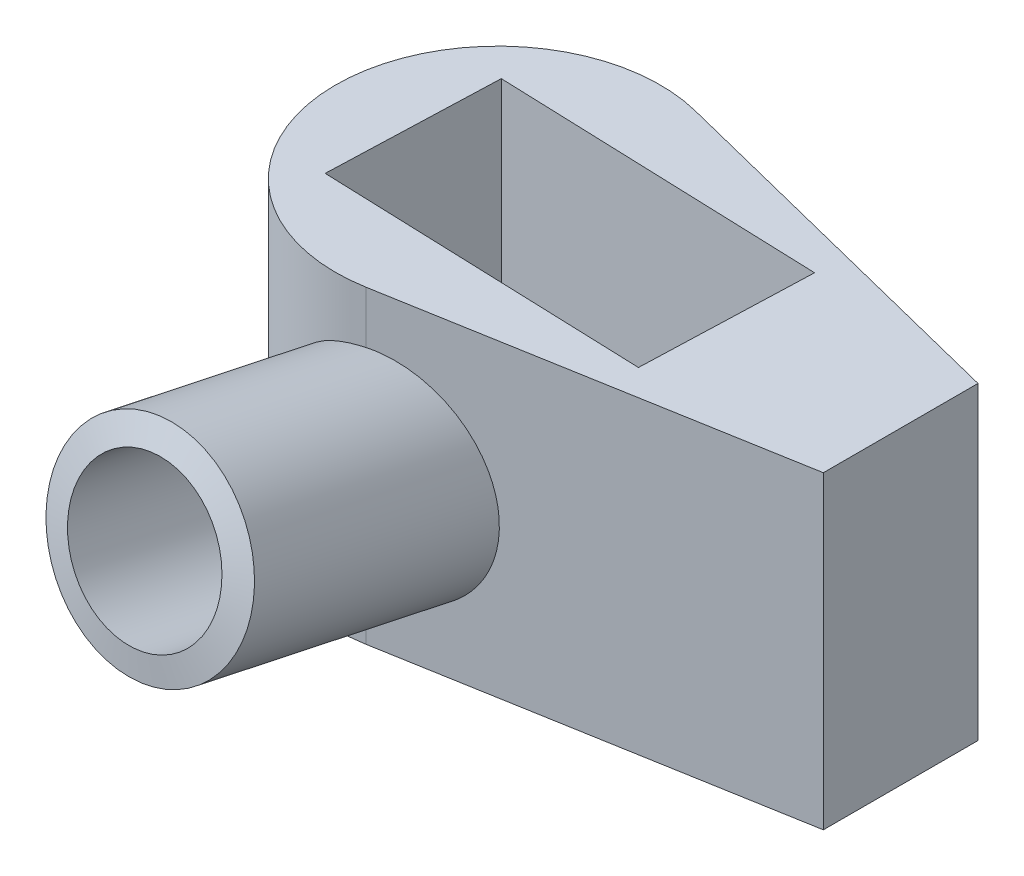
from build123d import *

# Parameters (mm, degrees)
CROQUIS1_R              = 21
SALIENTE_EXTRUIR1_DEPTH = 40
SALIENTE_EXTRUIR2_DEPTH = 40
SALIENTE_EXTRUIR3_REACH = 77.493
CROQUIS3_R              = 13.5
CROQUIS3_R_2            = 10
CROQUIS7_R              = 8.227269221
CROQUIS7_R_2            = 6
CORTAR_EXTRUIR6_DEPTH   = 6
CROQUIS8_R              = 6
CORTAR_EXTRUIR7_DEPTH   = 72.223648425
CORTAR_EXTRUIR8_START   = -25
CORTAR_EXTRUIR8_DEPTH   = 25
CROQUIS12_R             = 9.55
CORTAR_EXTRUIR9_DEPTH   = 5.5
CORTAR_EXTRUIR10_DEPTH  = 86.45696425


with BuildPart() as part:
    # Croquis1 → Saliente-Extruir1 (new body)
    with BuildSketch(Plane(origin=(0, 0, 0), x_dir=(1, 0, 0), z_dir=(0, 1, 0))):
        with Locations(Location((0, 0, 0), (0, 0, 270))):
            Circle(CROQUIS1_R)
    extrude(amount=SALIENTE_EXTRUIR1_DEPTH)

    # Croquis2 → Saliente-Extruir2 (add)
    with BuildSketch(Plane(origin=(0, 0, 0), x_dir=(1, 0, 0), z_dir=(0, 1, 0))):
        with BuildLine():
            Line((53.975127576, 8.110971331), (53.975127576, -11.889028669))
            Line((53.975127576, -11.889028669), (3.613793412, -20.686722727))
            ThreePointArc((3.613793412, -20.686722727), (20.98607707, -0.764571273), (5.109545014, 20.368911354))
            Line((5.109545014, 20.368911354), (53.975127576, 8.110971331))
        make_face()
    extrude(amount=SALIENTE_EXTRUIR2_DEPTH)

    # Croquis3 → Saliente-Extruir3 (add, up to next)
    with BuildSketch(Plane(origin=(5.109545014, 0, -20.368911354), x_dir=(-0.9699481597219111, 0, -0.24331166731597212), z_dir=(0.2433116673159721, 0, -0.969948159721911)), mode=Mode.PRIVATE) as saliente_extruir3_sk1:
        with Locations((0, 20)):
            Circle(CROQUIS3_R)
        with Locations((0, 20)):
            Circle(CROQUIS3_R_2, mode=Mode.SUBTRACT)
    saliente_extruir3_tool1 = extrude(saliente_extruir3_sk1.sketch, amount=-SALIENTE_EXTRUIR3_REACH, mode=Mode.PRIVATE) - part.part
    add(saliente_extruir3_tool1.solids().sort_by_distance((17.833482, 20, -17.177109))[0])

    # Croquis7 → Cortar-Extruir6 (cut)
    with BuildSketch(Plane.XZ):
        with Locations(Location((0, 0, 0), (0, 0, 270))):
            Circle(CROQUIS7_R)
        with Locations(Location((0, 0, 0), (0, 0, 270))):
            Circle(CROQUIS7_R_2, mode=Mode.SUBTRACT)
    extrude(amount=-CORTAR_EXTRUIR6_DEPTH, mode=Mode.SUBTRACT)

    # Croquis8 → Cortar-Extruir7 (cut, through all)
    with BuildSketch(Plane.XZ):
        with Locations(Location((0, 0, 0), (0, 0, 270))):
            Circle(CROQUIS8_R)
    extrude(amount=-CORTAR_EXTRUIR7_DEPTH, mode=Mode.SUBTRACT)

    # Croquis10 → Cortar-Extruir8 (cut)
    with BuildSketch(Plane(origin=(0, 40, 0), x_dir=(1, 0, 0), z_dir=(0, 1, 0)).offset(CORTAR_EXTRUIR8_START)):
        with BuildLine():
            Line((-5.995438853, 0.23390802), (-11.37823559, 0.424457107))
            Line((-11.37823559, 0.424457107), (-11.767631672, -10.575542893))
            Line((-11.767631672, -10.575542893), (30.232368328, -12.062327932))
            Line((30.232368328, -12.062327932), (30.62176441, -1.062327932))
            Line((30.62176441, -1.062327932), (5.996971268, -0.190619027))
            ThreePointArc((5.996971268, -0.190619027), (-0.212264906, -5.996244125), (-5.995438853, 0.23390802))
        make_face()
        with BuildLine():
            Line((-10.988839509, 11.424457107), (-11.37823559, 0.424457107))
            Line((-11.37823559, 0.424457107), (-5.995438853, 0.23390802))
            ThreePointArc((-5.995438853, 0.23390802), (0.116976243, 5.998859605), (6, 0))
            ThreePointArc((6, 0), (5.999242769, -0.095321543), (5.996971268, -0.190619027))
            Line((5.996971268, -0.190619027), (30.62176441, -1.062327932))
            Line((30.62176441, -1.062327932), (31.011160491, 9.937672068))
            Line((31.011160491, 9.937672068), (-10.988839509, 11.424457107))
        make_face()
    extrude(amount=CORTAR_EXTRUIR8_DEPTH, mode=Mode.SUBTRACT)

    # Croquis12 → Cortar-Extruir9 (cut)
    with BuildSketch(Plane(origin=(0, 15, 0), x_dir=(1, 0, 0), z_dir=(0, 1, 0))):
        with Locations(Location((0, 0, 0), (0, 0, 270))):
            Circle(CROQUIS12_R)
    extrude(amount=-CORTAR_EXTRUIR9_DEPTH, mode=Mode.SUBTRACT)

    # Croquis4 → Revolución3 (revolve)
    with BuildSketch(Plane(origin=(5.1, 0, 0), x_dir=(0, 0, -1), z_dir=(1, 0, 0)), mode=Mode.PRIVATE) as revoluci_n3_sk:
        Polygon((-24.61645883, 10.663524112), (-17.776790486, 9.208275528), (-17.776790486, 5.708275528), (-52.81645883, 13.163524112), (-52.81645883, 16.663524112), align=None)
    revolve(revoluci_n3_sk.sketch.rotate(Axis((5.1, 20.663524112, 24.61645883), (0, 0.20810764446485971, 0.9781059289848353)), 180), axis=Axis((5.1, 20.663524112, 24.61645883), (0, 0.20810764446485971, 0.9781059289848353)))

    # Croquis17 → Cortar-Extruir10 (cut, through all)
    with BuildSketch(Plane(origin=(0, 40, 0), x_dir=(1, 0, 0), z_dir=(0, 1, 0))):
        with BuildLine():
            Line((5.109545014, 20.368911354), (5.109545014, 31.680559043))
            Line((5.109545014, 31.680559043), (-13.688349404, 31.680559043))
            Line((-13.688349404, 31.680559043), (-13.688349404, 15.925736736))
            ThreePointArc((-13.688349404, 15.925736736), (-4.830571536, 20.436868122), (5.109545014, 20.368911354))
        make_face()
    extrude(amount=-CORTAR_EXTRUIR10_DEPTH, mode=Mode.SUBTRACT)


solid = part.part
